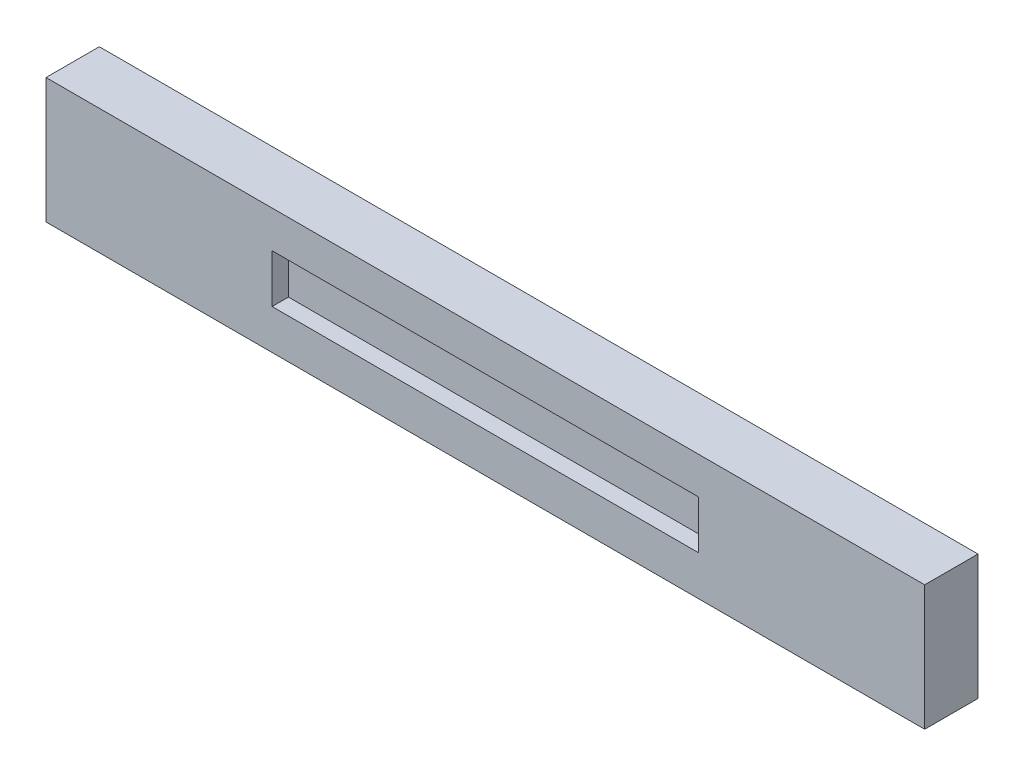
from build123d import *

# Parameters (mm, degrees)
CEK_DONMUS_ON_PU_37_5_1_START = 1
SKETCH1_W                     = 618
SKETCH1_H                     = 88
CEK_DONMUS_ON_PU_37_5_1_DEPTH = 37.5
CEK_DONMUS_ON_PU_37_5_2_START = 27
SKETCH2_W                     = 300
SKETCH2_H                     = 34
CEK_DONMUS_ON_PU_37_5_2_DEPTH = 14


with BuildPart() as part:
    # Sketch1 → CEK_donmus_on_pu_37.5_1 (new body)
    with BuildSketch(Plane.XY.offset(CEK_DONMUS_ON_PU_37_5_1_START)):
        with Locations((309, 44)):
            Rectangle(SKETCH1_W, SKETCH1_H)
    extrude(amount=CEK_DONMUS_ON_PU_37_5_1_DEPTH)

    # Sketch2 → CEK_donmus_on_pu_37.5_2 (cut)
    with BuildSketch(Plane.XY.offset(CEK_DONMUS_ON_PU_37_5_2_START)):
        with Locations((309, 45)):
            Rectangle(SKETCH2_W, SKETCH2_H)
    extrude(amount=CEK_DONMUS_ON_PU_37_5_2_DEPTH, mode=Mode.SUBTRACT)


solid = part.part
